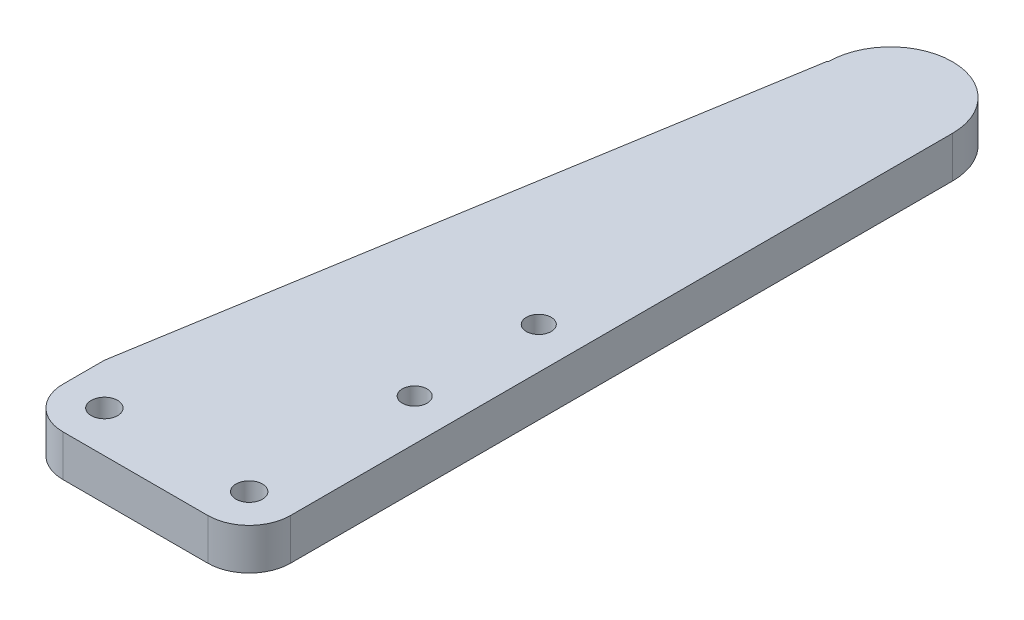
from build123d import *

# Parameters (mm, degrees)
SKETCH_1_R      = 1.6
SKETCH_1_R_2    = 1.5
EXTRUDE_1_DEPTH = 5
FILLET_1_R      = 5


with BuildPart() as part:
    # ｽｹｯﾁ1 → ﾎﾞｽ - 押し出し1 (new body)
    with BuildSketch(Plane(origin=(0, 0, 0), x_dir=(1, 0, 0), z_dir=(0, 1, 0))):
        with BuildLine():
            Line((-13.75, -32.5), (-13.75, -42.5))
            Line((-13.75, -42.5), (13.75, -42.5))
            Line((13.75, -42.5), (13.75, 42.5))
            ThreePointArc((13.75, 42.5), (6.25, 50), (-1.25, 42.5))
            Line((-1.25, 42.5), (-1.351786435, 42.5))
            Line((-1.351786435, 42.5), (-13.75, -32.5))
        make_face()
        with Locations(Location((-8.75, -37.5, 0), (0, 0, 270))):
            Circle(SKETCH_1_R, mode=Mode.SUBTRACT)
        with Locations(Location((8.75, -37.5, 0), (0, 0, 270))):
            Circle(SKETCH_1_R, mode=Mode.SUBTRACT)
        with Locations(Location((8.75, -17.5, 0), (0, 0, 270))):
            Circle(SKETCH_1_R_2, mode=Mode.SUBTRACT)
        with Locations(Location((8.75, -2.5, 0), (0, 0, 270))):
            Circle(SKETCH_1_R_2, mode=Mode.SUBTRACT)
    extrude(amount=EXTRUDE_1_DEPTH)

    # ﾌｨﾚｯﾄ1
    fillet_1_edges = [part.edges().sort_by_distance(p)[0] for p in [
        (13.75, 2.5, 42.5),
        (-13.75, 2.5, 42.5),
    ]]
    fillet(fillet_1_edges, radius=FILLET_1_R)


solid = part.part
